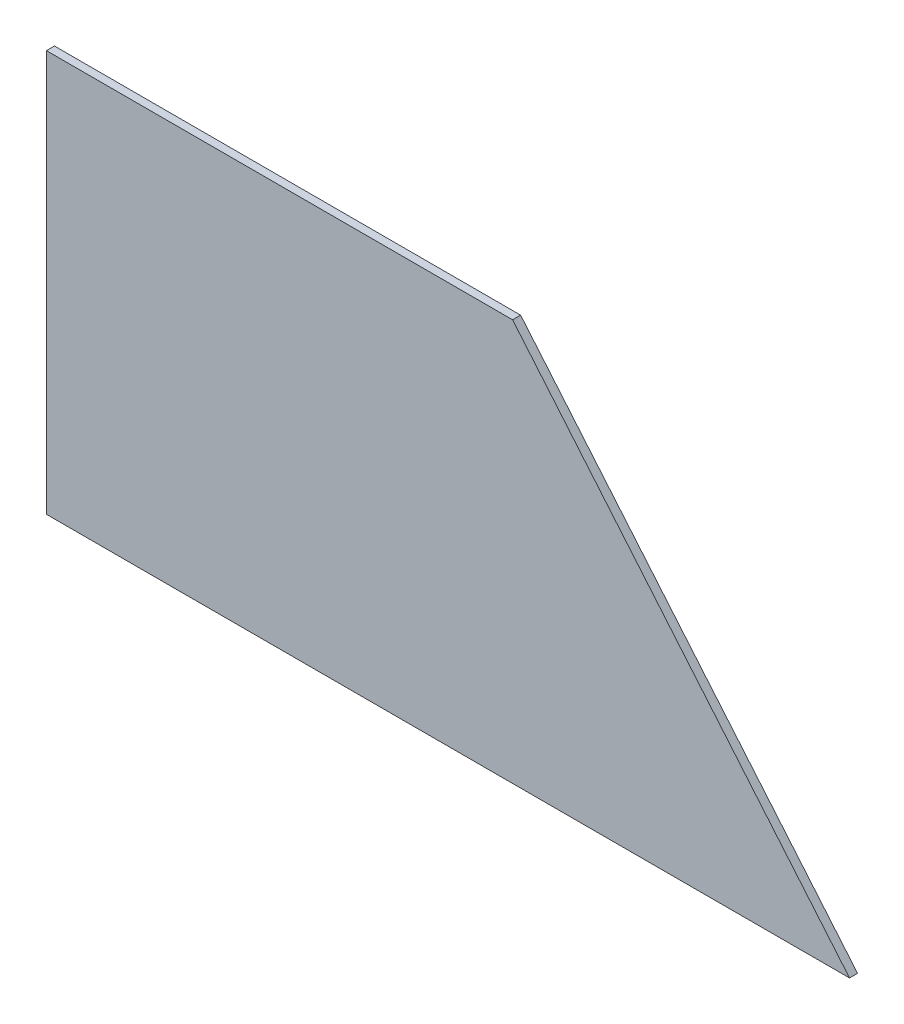
from build123d import *

# Parameters (mm, degrees)
EXTRUDE_1_DEPTH = 2


with BuildPart() as part:
    # ｽｹｯﾁ1 → ﾎﾞｽ - 押し出し1 (new body)
    with BuildSketch(Plane.XY):
        Polygon((0, 0), (200, 0), (116.090036882, 100), (0, 100), align=None)
    extrude(amount=EXTRUDE_1_DEPTH)


solid = part.part
